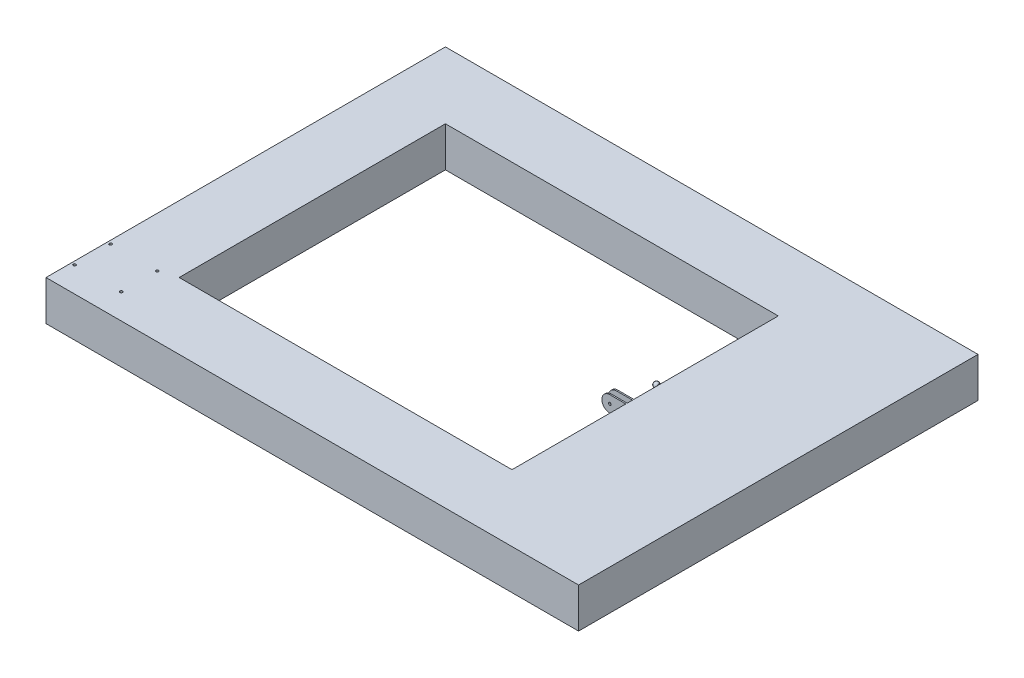
from build123d import *

# Parameters (mm, degrees)
SKETCH1_W           = 4000
SKETCH1_H           = 300
BOSS_EXTRUDE1_DEPTH = 3000
SKETCH3_W           = 2500
SKETCH3_H           = 2000
CUT_EXTRUDE1_DEPTH  = 3000
SKETCH6_R           = 10
BOSS_EXTRUDE2_DEPTH = 10
SKETCH7_R           = 10
BOSS_EXTRUDE3_DEPTH = 10
SKETCH9_R           = 10
CUT_EXTRUDE2_DEPTH  = 70


with BuildPart() as part:
    # Sketch1 → Boss-Extrude1 (new body)
    with BuildSketch(Plane.XY):
        with Locations((2000, 150)):
            Rectangle(SKETCH1_W, SKETCH1_H)
    extrude(amount=BOSS_EXTRUDE1_DEPTH)

    # Sketch3 → Cut-Extrude1 (cut)
    with BuildSketch(Plane(origin=(0, 300, 0), x_dir=(1, 0, 0), z_dir=(0, 1, 0))):
        with Locations((1750, -1500)):
            Rectangle(SKETCH3_W, SKETCH3_H)
    extrude(amount=-CUT_EXTRUDE1_DEPTH, mode=Mode.SUBTRACT)

    # Sketch6 → Boss-Extrude2 (add)
    with BuildSketch(Plane(origin=(0, 0, 1645), x_dir=(-1, 0, 0), z_dir=(0, 0, -1))):
        with BuildLine():
            Line((-3000, 300), (-3000, 180))
            Line((-3000, 180), (-2880, 180))
            ThreePointArc((-2880, 180), (-2820, 240), (-2880, 300))
            Line((-2880, 300), (-3000, 300))
        make_face()
        with Locations((-2880, 240)):
            Circle(SKETCH6_R, mode=Mode.SUBTRACT)
    extrude(amount=BOSS_EXTRUDE2_DEPTH)

    # Sketch7 → Boss-Extrude3 (add)
    with BuildSketch(Plane(origin=(0, 0, 1595), x_dir=(-1, 0, 0), z_dir=(0, 0, -1))):
        with BuildLine():
            Line((-3000, 300), (-3000, 180))
            Line((-3000, 180), (-2880, 180))
            ThreePointArc((-2880, 180), (-2820, 240), (-2880, 300))
            Line((-2880, 300), (-3000, 300))
        make_face()
        with Locations((-2880, 240)):
            Circle(SKETCH7_R, mode=Mode.SUBTRACT)
    extrude(amount=BOSS_EXTRUDE3_DEPTH)

    # Sketch8 → Revolve1 (revolve)
    with BuildSketch(Plane(origin=(0, 0, 1385), x_dir=(-1, 0, 0), z_dir=(0, 0, -1)), mode=Mode.PRIVATE) as revolve1_sk:
        with BuildLine():
            Line((-3000, 300), (-3000, 280))
            Line((-3000, 280), (-2950, 280))
            ThreePointArc((-2950, 280), (-2963.709750078, 298.985066655), (-2986.043275591, 291.942081406))
            Line((-2986.043275591, 291.942081406), (-3000, 300))
        make_face()
    revolve(revolve1_sk.sketch.rotate(Axis((3000, 280, 1385), (-1, 0, 0)), 90), axis=Axis((3000, 280, 1385), (-1, 0, 0)))

    # Sketch9 → Cut-Extrude2 (cut)
    with BuildSketch(Plane(origin=(0, 300, 0), x_dir=(1, 0, 0), z_dir=(0, 1, 0))):
        with Locations(Location((25, -2540, 0), (0, 0, 270))):
            Circle(SKETCH9_R)
        with Locations(Location((375, -2540, 0), (0, 0, 270))):
            Circle(SKETCH9_R)
        with Locations(Location((25, -2810, 0), (0, 0, 270))):
            Circle(SKETCH9_R)
        with Locations(Location((375, -2810, 0), (0, 0, 270))):
            Circle(SKETCH9_R)
    extrude(amount=-CUT_EXTRUDE2_DEPTH, mode=Mode.SUBTRACT)


solid = part.part
